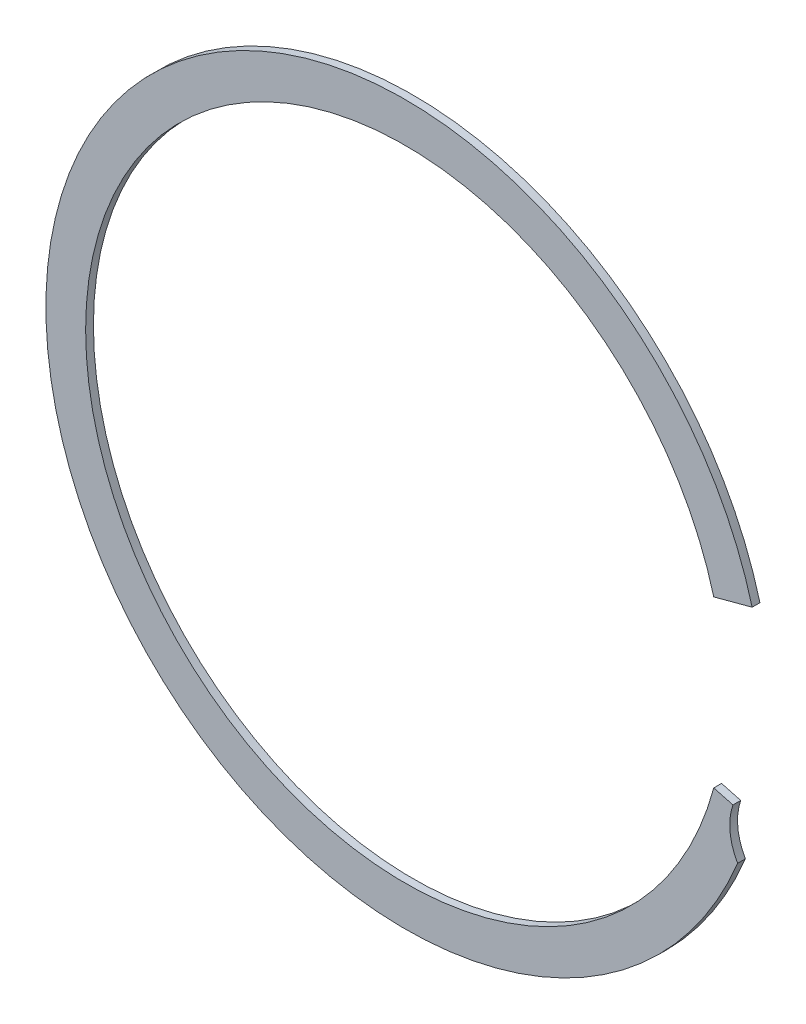
from build123d import *

# Parameters (mm, degrees)
BOSS_EXTRUDE1_DEPTH = 0.7874


with BuildPart() as part:
    # Sketch2 → Boss-Extrude1 (new body)
    with BuildSketch(Plane.XY):
        with BuildLine():
            Line((31.171102562, 8.352271759), (33.109329325, 8.871618055))
            Line((33.109329325, 8.871618055), (35.047556088, 9.390964351))
            ThreePointArc((35.047556088, 9.390964351), (-36.211242798, 2.295058655), (33.581480457, -13.740653898))
            ThreePointArc((33.581480457, -13.740653898), (32.810406003, -11.358014898), (33.109329325, -8.871618055))
            Line((33.109329325, -8.871618055), (31.171102562, -8.352271759))
            ThreePointArc((31.171102562, -8.352271759), (-32.2707, 0), (31.171102562, 8.352271759))
        make_face()
    extrude(amount=BOSS_EXTRUDE1_DEPTH)


solid = part.part
